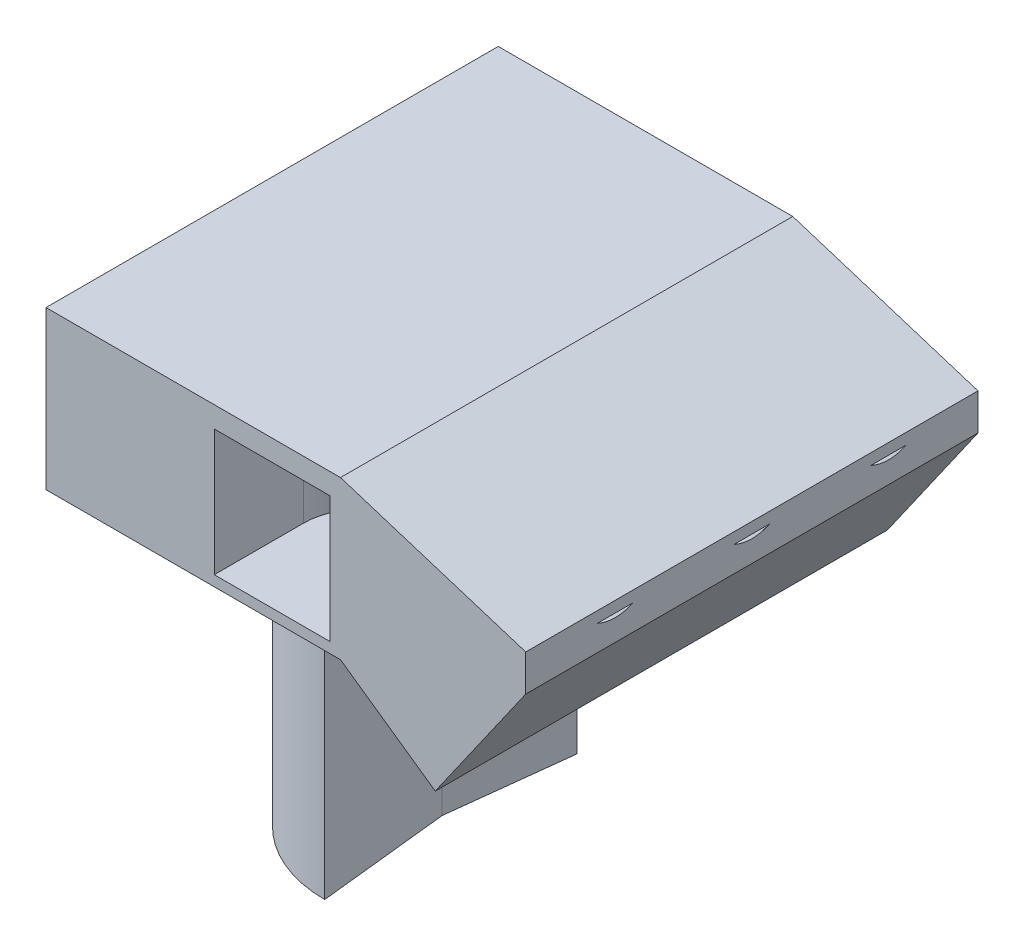
from build123d import *

# Parameters (mm, degrees)
HOUSING_DEPTH                  = 3
KINK_HOUSING_DEPTH             = 8.6
KINK_SLOTS_REACH               = 11.941
KINK_SLOTS_OFFSET_FROM_SURFACE = 0.2
SKETCH18_RX                    = 1.1
SKETCH18_RY                    = 0.901067249
SIDE_START                     = 0.2
SKETCH1_14_R                   = 1.1
SIDE_CUTS_DEPTH                = 2.6
SKETCH1_15_R                   = 1.1
CENTER_CUT_DEPTH               = 2.8
BOSS_EXTRUDE4_START            = -0.2
BOSS_EXTRUDE4_DEPTH            = 0.2
BOSS_EXTRUDE5_DEPTH            = 6


with BuildPart() as part:
    # Sketch1 → Housing (new body)
    with BuildSketch(Plane(origin=(0, 0, 0), x_dir=(1, 0, 0), z_dir=(0, 1, 0))):
        Polygon((3.9, 6.9), (-1.7, 6.9), (-1.7, -1.7), (3.9, -1.7), (3.9, 5.2), align=None)
    extrude(amount=HOUSING_DEPTH)

    # Sketch1<14> → Side Cuts (cut)
    with BuildSketch(Plane(origin=(0, 0, 0), x_dir=(1, 0, 0), z_dir=(0, 1, 0)).offset(SIDE_START)):
        with BuildLine():
            Line((3.7, 5.2), (3.7, 6.9))
            Line((3.7, 6.9), (1.5, 6.9))
            Line((1.5, 6.9), (1.5, 5.2))
            ThreePointArc((1.5, 5.2), (2.6, 6.3), (3.7, 5.2))
        make_face()
        with Locations((2.6, 5.2)):
            Circle(SKETCH1_14_R)
        with Locations((0, 5.2)):
            Circle(SKETCH1_14_R)
        with BuildLine():
            Line((0, 6.3), (-1.7, 6.3))
            Line((-1.7, 6.3), (-1.7, 4.1))
            Line((-1.7, 4.1), (0, 4.1))
            ThreePointArc((0, 4.1), (-1.1, 5.2), (0, 6.3))
        make_face()
        with Locations((0, 2.6)):
            Circle(SKETCH1_14_R)
        with BuildLine():
            Line((0, 3.7), (-1.7, 3.7))
            Line((-1.7, 3.7), (-1.7, 1.5))
            Line((-1.7, 1.5), (0, 1.5))
            ThreePointArc((0, 1.5), (-1.1, 2.6), (0, 3.7))
        make_face()
        with Locations((2.6, 0)):
            Circle(SKETCH1_14_R)
        with BuildLine():
            Line((1.5, -1.7), (3.7, -1.7))
            Line((3.7, -1.7), (3.7, 0))
            ThreePointArc((3.7, 0), (2.6, -1.1), (1.5, 0))
            Line((1.5, 0), (1.5, -1.7))
        make_face()
        Circle(SKETCH1_14_R)
        with BuildLine():
            Line((-1.7, 1.1), (-1.7, -1.1))
            Line((-1.7, -1.1), (0, -1.1))
            ThreePointArc((0, -1.1), (-1.1, 0), (0, 1.1))
            Line((0, 1.1), (-1.7, 1.1))
        make_face()
    extrude(amount=SIDE_CUTS_DEPTH, mode=Mode.SUBTRACT)

    # Sketch1<15> → Center Cut (cut)
    with BuildSketch(Plane(origin=(0, 0, 0), x_dir=(1, 0, 0), z_dir=(0, 1, 0))):
        with Locations(Location((2.6, 2.6, 0), (0, 0, 270))):
            Circle(SKETCH1_15_R)
    extrude(amount=CENTER_CUT_DEPTH, mode=Mode.SUBTRACT)



with BuildPart() as body_2:
    # Tilted Magnet → Kink Housing (new body)
    with BuildSketch(Plane(origin=(0, 0, -6.9), x_dir=(-1, 0, 0), z_dir=(0, 0, -1))):
        Polygon((-3.9, 3), (-7.422863806, 1.889245308), (-7.422863806, 1.195587973), (-5.702134497, -1.26186816), (-3.9, 0), align=None)
    extrude(amount=-KINK_HOUSING_DEPTH)

    # Kink Slots: up to this face of the body (flat: up to its plane, moved by the offset)
    kink_slots_end = Plane(body_2.part.faces().sort_by_distance((5.661431903, 2.444622654, -2.6))[0]).offset(-KINK_SLOTS_OFFSET_FROM_SURFACE)
    # Sketch18 → Kink Slots (cut, up to the picked face)
    with BuildSketch(Plane(origin=(1.283060721, 1.832400611, 0), x_dir=(0.8191520442889985, -0.5735764363510366, 0), z_dir=(-0.5735764363510366, -0.8191520442889985, 0)), mode=Mode.PRIVATE) as kink_slots_sk1:
        with Locations(Location((4.25959063, -5.2), (0, 0, 90))):
            Ellipse(SKETCH18_RX, SKETCH18_RY)
    kink_slots_tool1 = split(extrude(kink_slots_sk1.sketch, amount=-KINK_SLOTS_REACH, mode=Mode.PRIVATE), bisect_by=kink_slots_end, keep=Keep.BOTH, mode=Mode.PRIVATE)
    # Sketch18 → Kink Slots (cut, up to the picked face)
    with BuildSketch(Plane(origin=(1.283060721, 1.832400611, 0), x_dir=(0.8191520442889985, -0.5735764363510366, 0), z_dir=(-0.5735764363510366, -0.8191520442889985, 0)), mode=Mode.PRIVATE) as kink_slots_sk2:
        with Locations(Location((4.25959063, -2.6), (0, 0, -90))):
            Ellipse(SKETCH18_RX, SKETCH18_RY)
    kink_slots_tool2 = split(extrude(kink_slots_sk2.sketch, amount=-KINK_SLOTS_REACH, mode=Mode.PRIVATE), bisect_by=kink_slots_end, keep=Keep.BOTH, mode=Mode.PRIVATE)
    # Sketch18 → Kink Slots (cut, up to the picked face)
    with BuildSketch(Plane(origin=(1.283060721, 1.832400611, 0), x_dir=(0.8191520442889985, -0.5735764363510366, 0), z_dir=(-0.5735764363510366, -0.8191520442889985, 0)), mode=Mode.PRIVATE) as kink_slots_sk3:
        with Locations(Location((4.25959063, 0), (0, 0, 90))):
            Ellipse(SKETCH18_RX, SKETCH18_RY)
    kink_slots_tool3 = split(extrude(kink_slots_sk3.sketch, amount=-KINK_SLOTS_REACH, mode=Mode.PRIVATE), bisect_by=kink_slots_end, keep=Keep.BOTH, mode=Mode.PRIVATE)
    add(kink_slots_tool1.solids().sort_by(Axis((4.772313, -0.6108, -5.2), (0.5735764363510366, 0.8191520442889985, 0)))[0], mode=Mode.SUBTRACT)
    add(kink_slots_tool2.solids().sort_by(Axis((4.772313, -0.6108, -2.6), (0.5735764363510366, 0.8191520442889985, 0)))[0], mode=Mode.SUBTRACT)
    add(kink_slots_tool3.solids().sort_by(Axis((4.772313, -0.6108, 0), (0.5735764363510366, 0.8191520442889985, 0)))[0], mode=Mode.SUBTRACT)


with BuildPart() as part_1:
    add(part.part)

    add(body_2.part)  # Boss-Extrude4 merges body 2
    # Sketch19 → Boss-Extrude4 (add)
    with BuildSketch(Plane(origin=(0, 3, 0), x_dir=(1, 0, 0), z_dir=(0, 1, 0)).offset(BOSS_EXTRUDE4_START)):
        Polygon((3.9, 6.9), (-1.7, 6.9), (-1.7, -1.7), (3.9, -1.7), (3.9, -1.440815164), (-1.440815164, -1.440815164), (-1.440815164, 6.640815164), (3.9, 6.640815164), align=None)
    extrude(amount=-BOSS_EXTRUDE4_DEPTH)

    # Sketch20 → Boss-Extrude5 (add)
    with BuildSketch(Plane.XZ):
        with BuildLine():
            Line((1.432886326, -2.7), (1.7, -0.2))
            ThreePointArc((1.7, -0.2), (-0.7, -2.6), (1.7, -5))
            Line((1.7, -5), (1.432886326, -2.7))
        make_face()
    extrude(amount=BOSS_EXTRUDE5_DEPTH)


solid = part_1.part
